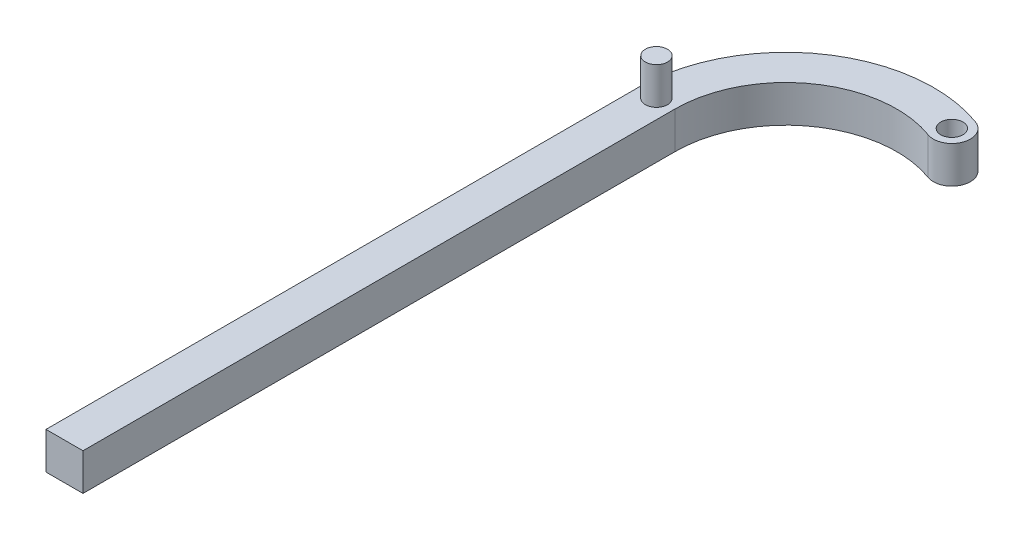
from build123d import *

# Parameters (mm, degrees)
SKETCH1_R           = 20
BOSS_EXTRUDE1_DEPTH = 5
SKETCH2_R           = 15
CUT_EXTRUDE1_DEPTH  = 5
CUT_EXTRUDE3_START  = -5
CUT_EXTRUDE3_DEPTH  = 5
SKETCH7_W           = 5
SKETCH7_H           = 80
BOSS_EXTRUDE2_DEPTH = 5
BOSS_EXTRUDE3_DEPTH = 5
SKETCH10_R          = 1.5
CUT_EXTRUDE4_DEPTH  = 5
SKETCH11_R          = 1.5
BOSS_EXTRUDE4_DEPTH = 5


with BuildPart() as part:
    # Sketch1 → Boss-Extrude1 (new body)
    with BuildSketch(Plane(origin=(0, 0, 0), x_dir=(1, 0, 0), z_dir=(0, 1, 0))):
        with Locations(Location((0, 0, 0), (0, 0, 270))):
            Circle(SKETCH1_R)
    extrude(amount=BOSS_EXTRUDE1_DEPTH)

    # Sketch2 → Cut-Extrude1 (cut)
    with BuildSketch(Plane(origin=(0, 5, 0), x_dir=(1, 0, 0), z_dir=(0, 1, 0))):
        with Locations(Location((0, 0, 0), (0, 0, 270))):
            Circle(SKETCH2_R)
    extrude(amount=-CUT_EXTRUDE1_DEPTH, mode=Mode.SUBTRACT)

    # Sketch3 → Cut-Extrude3 (cut)
    with BuildSketch(Plane(origin=(0, 5, 0), x_dir=(1, 0, 0), z_dir=(0, 1, 0)).offset(CUT_EXTRUDE3_START)):
        with BuildLine():
            Line((6.840402867, 18.793852416), (0, 0))
            Line((0, 0), (-20, 0))
            ThreePointArc((-20, 0), (11.471528727, -16.383040886), (6.840402867, 18.793852416))
        make_face()
    extrude(amount=CUT_EXTRUDE3_DEPTH, mode=Mode.SUBTRACT)

    # Sketch7 → Boss-Extrude2 (add)
    with BuildSketch(Plane(origin=(0, 5, 0), x_dir=(1, 0, 0), z_dir=(0, 1, 0))):
        with Locations((-17.5, -40)):
            Rectangle(SKETCH7_W, SKETCH7_H)
    extrude(amount=-BOSS_EXTRUDE2_DEPTH)

    # Sketch9 → Boss-Extrude3 (add)
    with BuildSketch(Plane(origin=(0, 5, 0), x_dir=(1, 0, 0), z_dir=(0, 1, 0))):
        with BuildLine():
            Line((6.840402867, 18.793852416), (5.13030215, 14.095389312))
            ThreePointArc((5.13030215, 14.095389312), (8.33458406, 15.589570505), (6.840402867, 18.793852416))
        make_face()
    extrude(amount=-BOSS_EXTRUDE3_DEPTH)

    # Sketch10 → Cut-Extrude4 (cut)
    with BuildSketch(Plane(origin=(0, 5, 0), x_dir=(1, 0, 0), z_dir=(0, 1, 0))):
        with Locations(Location((5.985352508, 16.444620864, 0), (0, 0, 270))):
            Circle(SKETCH10_R)
    extrude(amount=-CUT_EXTRUDE4_DEPTH, mode=Mode.SUBTRACT)

    # Sketch11 → Boss-Extrude4 (add)
    with BuildSketch(Plane(origin=(0, 5, 0), x_dir=(1, 0, 0), z_dir=(0, 1, 0))):
        with Locations(Location((-17.5, 0, 0), (0, 0, 270))):
            Circle(SKETCH11_R)
    extrude(amount=BOSS_EXTRUDE4_DEPTH)


solid = part.part
